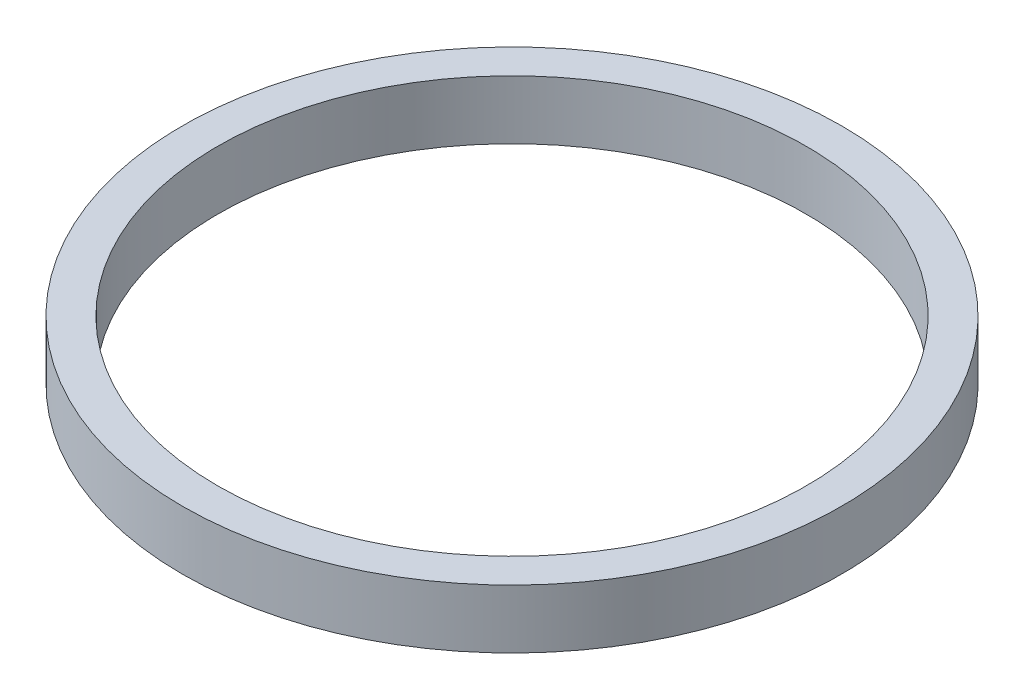
from build123d import *

# Parameters (mm, degrees)
SKETCH1_R           = 14
SKETCH1_R_2         = 12.5
BOSS_EXTRUDE1_DEPTH = 2.5


with BuildPart() as part:
    # Sketch1 → Boss-Extrude1 (new body)
    with BuildSketch(Plane(origin=(0, 0, 0), x_dir=(1, 0, 0), z_dir=(0, 1, 0))):
        with Locations(Location((0, 0, 0), (0, 0, 270))):
            Circle(SKETCH1_R)
        with Locations(Location((0, 0, 0), (0, 0, 270))):
            Circle(SKETCH1_R_2, mode=Mode.SUBTRACT)
    extrude(amount=BOSS_EXTRUDE1_DEPTH)


solid = part.part
